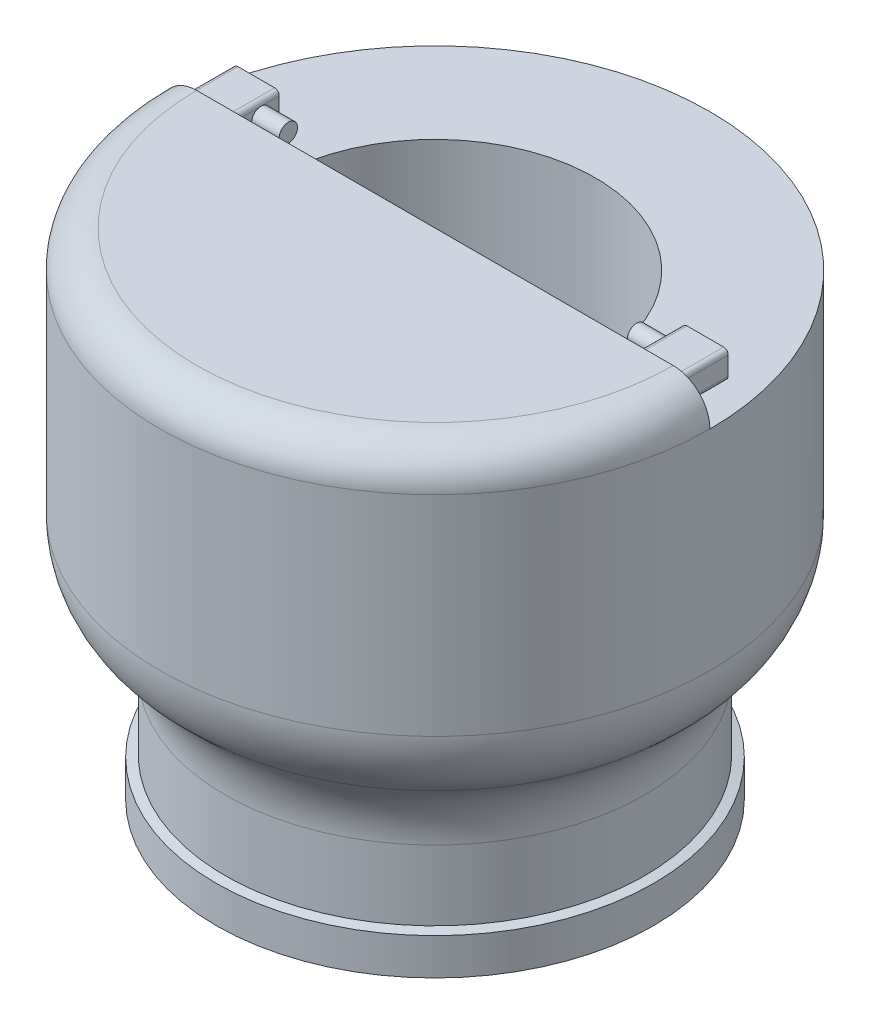
from build123d import *

# Parameters (mm, degrees)
CUT_EXTRUDE3_DEPTH      = 45
CUT_EXTRUDE3_DEPTH_BACK = 20
CUT_EXTRUDE5_START      = -5
CUT_EXTRUDE5_DEPTH      = 5
BOSS_EXTRUDE2_DEPTH     = 5
SKETCH14_R              = 1
BOSS_EXTRUDE3_DEPTH     = 3
BOSS_EXTRUDE4_START     = 3
SKETCH15_R              = 1
BOSS_EXTRUDE4_DEPTH     = 3
CUT_EXTRUDE6_DEPTH      = 22


with BuildPart() as part:
    # Sketch1 → Revolve1 (revolve)
    with BuildSketch(Plane.XY, mode=Mode.PRIVATE) as revolve1_sk:
        with BuildLine():
            Line((20.9, 0), (23.871591838, 0))
            Line((23.871591838, 0), (23.871591838, 4))
            Line((23.871591838, 4), (22.9, 4.236662843))
            Line((22.9, 4.236662843), (22.9, 11.874576818))
            ThreePointArc((22.9, 11.874576818), (23.83692213, 16.100759435), (26.472123903, 19.535021249))
            Line((26.472123903, 19.535021249), (26.427876097, 19.497892931))
            ThreePointArc((26.427876097, 19.497892931), (29.06307787, 22.932154745), (30, 27.158337362))
            Line((30, 27.158337362), (30, 50))
            ThreePointArc((30, 50), (28.828427125, 52.828427125), (26, 54))
            Line((26, 54), (0, 54))
            Line((0, 54), (0, 15))
            Line((0, 15), (19.9, 15))
            ThreePointArc((19.9, 15), (20.607106781, 14.707106781), (20.9, 14))
            Line((20.9, 14), (20.9, 0))
        make_face()
    revolve(revolve1_sk.sketch.rotate(Axis((0, 0, 0), (0, 1, 0)), 90), axis=Axis((0, 0, 0), (0, 1, 0)))

    # Sketch11 → Cut-Extrude3 (cut, two sides: drawn at the far end of the back side and taken through both)
    with BuildSketch(Plane(origin=(0, 17, 0), x_dir=(1, 0, 0), z_dir=(0, 1, 0)).offset(-CUT_EXTRUDE3_DEPTH_BACK)):
        with BuildLine():
            Line((-17.5, 0), (17.5, 0))
            ThreePointArc((17.5, 0), (0, 17.5), (-17.5, 0))
        make_face()
    extrude(amount=CUT_EXTRUDE3_DEPTH + CUT_EXTRUDE3_DEPTH_BACK, mode=Mode.SUBTRACT)

    # Sketch9 → Cut-Extrude5 (cut)
    with BuildSketch(Plane(origin=(0, 50, 0), x_dir=(-1, 0, 0), z_dir=(0, -1, 0)).offset(CUT_EXTRUDE5_START)):
        with BuildLine():
            Line((-30, 0), (30, 0))
            ThreePointArc((30, 0), (0, 30), (-30, 0))
        make_face()
    extrude(amount=CUT_EXTRUDE5_DEPTH, mode=Mode.SUBTRACT)

    # Sketch13 → Boss-Extrude2 (add)
    with BuildSketch(Plane(origin=(0, 0, 0), x_dir=(-1, 0, 0), z_dir=(0, 0, -1))):
        with BuildLine():
            Line((22.5, 53.5), (26.5, 53.5))
            ThreePointArc((26.5, 53.5), (26.853553391, 53.353553391), (27, 53))
            Line((27, 53), (27, 51))
            ThreePointArc((27, 51), (26.853553391, 50.646446609), (26.5, 50.5))
            Line((26.5, 50.5), (22.5, 50.5))
            ThreePointArc((22.5, 50.5), (22.146446609, 50.646446609), (22, 51))
            Line((22, 51), (22, 53))
            ThreePointArc((22, 53), (22.146446609, 53.353553391), (22.5, 53.5))
        make_face()
        with BuildLine():
            Line((-26.5, 53.5), (-22.5, 53.5))
            ThreePointArc((-22.5, 53.5), (-22.146446609, 53.353553391), (-22, 53))
            Line((-22, 53), (-22, 51))
            ThreePointArc((-22, 51), (-22.146446609, 50.646446609), (-22.5, 50.5))
            Line((-22.5, 50.5), (-26.5, 50.5))
            ThreePointArc((-26.5, 50.5), (-26.853553391, 50.646446609), (-27, 51))
            Line((-27, 51), (-27, 53))
            ThreePointArc((-27, 53), (-26.853553391, 53.353553391), (-26.5, 53.5))
        make_face()
    extrude(amount=BOSS_EXTRUDE2_DEPTH)

    # Sketch14 → Boss-Extrude3 (add)
    with BuildSketch(Plane.ZY.offset(-22)):
        with Locations(Location((-3, 52, 0), (0, 0, 270))):
            Circle(SKETCH14_R)
    extrude(amount=BOSS_EXTRUDE3_DEPTH)

    # Sketch15 → Boss-Extrude4 (add)
    with BuildSketch(Plane(origin=(-22, 0, 0), x_dir=(0, 0, -1), z_dir=(1, 0, 0)).offset(BOSS_EXTRUDE4_START)):
        with Locations(Location((3, 52, 0), (0, 0, 270))):
            Circle(SKETCH15_R)
    extrude(amount=-BOSS_EXTRUDE4_DEPTH)

    # Sketch16 → Cut-Extrude6 (cut)
    with BuildSketch(Plane(origin=(0, 50, 0), x_dir=(-1, 0, 0), z_dir=(0, -1, 0))):
        with BuildLine():
            Line((28.470379344, -4), (-28.470379344, -4))
            ThreePointArc((-28.470379344, -4), (0, -28.75), (28.470379344, -4))
        make_face()
    extrude(amount=CUT_EXTRUDE6_DEPTH, mode=Mode.SUBTRACT)


solid = part.part
